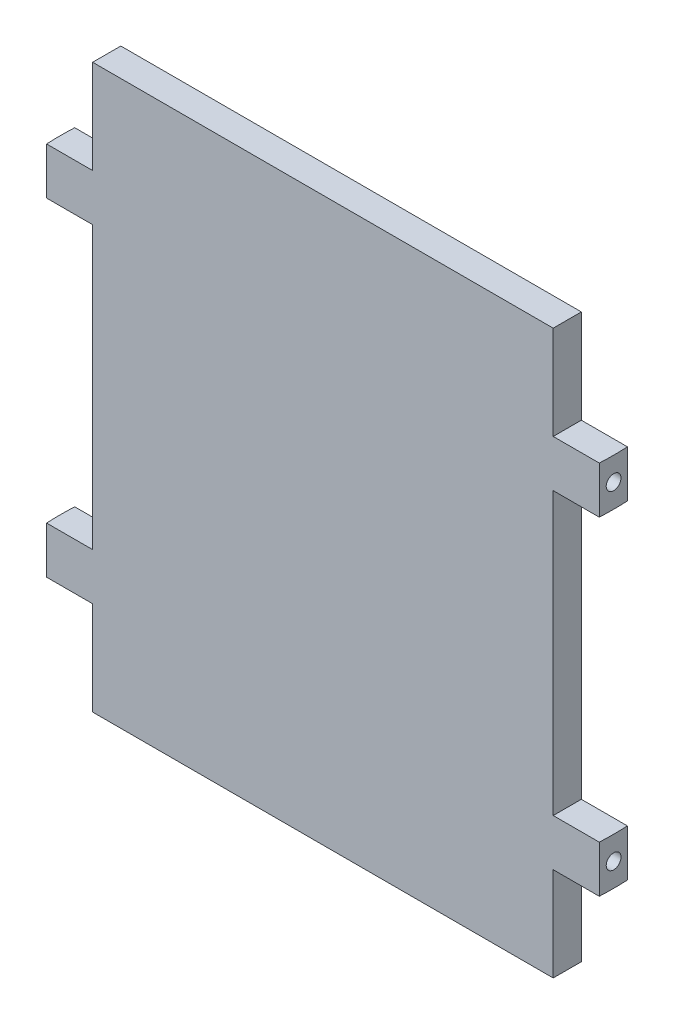
from build123d import *

# Parameters (mm, degrees)
Y_KSEKLIK_EKSTR_ZYON1_DEPTH             = 6
M3X0_5_HELISARMAL_IN_DI_LI_DELIK1_D     = 3.15
M3X0_5_HELISARMAL_IN_DI_LI_DELIK1_DEPTH = 7.5
M3X0_5_HELISARMAL_IN_DI_LI_DELIK1_TIP   = 0.946355475
M3X0_5_HELISARMAL_IN_DI_LI_DELIK2_D     = 3.15
M3X0_5_HELISARMAL_IN_DI_LI_DELIK2_DEPTH = 7.5
M3X0_5_HELISARMAL_IN_DI_LI_DELIK2_TIP   = 0.946355475
IZIM2_R                                 = 69
IZIM2_R_2                               = 59
KES_EKSTR_ZYON_NCE1_DEPTH               = 150


with BuildPart() as part:
    # Çizim1 → Yükseklik-Ekstrüzyon1 (new body)
    with BuildSketch(Plane.XY):
        Polygon((0, 20), (-10, 20), (-10, 30), (0, 30), (0, 90), (-10, 90), (-10, 100), (0, 100), (0, 120), (98.2, 120), (98.2, 100), (108.2, 100), (108.2, 90), (98.2, 90), (98.2, 30), (108.2, 30), (108.2, 20), (98.2, 20), (98.2, 0), (0, 0), align=None)
    extrude(amount=Y_KSEKLIK_EKSTR_ZYON1_DEPTH)

    # M3x0.5 Helisarmal İçin Dişli Delik1
    with Locations(Plane.ZY.offset(10)):
        with Locations((3, 25), (3, 95)):
            Hole(M3X0_5_HELISARMAL_IN_DI_LI_DELIK1_D / 2, depth=M3X0_5_HELISARMAL_IN_DI_LI_DELIK1_DEPTH)
            with Locations((0, 0, -(M3X0_5_HELISARMAL_IN_DI_LI_DELIK1_DEPTH + M3X0_5_HELISARMAL_IN_DI_LI_DELIK1_TIP / 2))):  # 118° drill point
                Cone(0, M3X0_5_HELISARMAL_IN_DI_LI_DELIK1_D / 2, M3X0_5_HELISARMAL_IN_DI_LI_DELIK1_TIP, mode=Mode.SUBTRACT)

    # M3x0.5 Helisarmal İçin Dişli Delik2
    with Locations(Plane(origin=(108.2, 0, 0), x_dir=(0, 0, -1), z_dir=(1, 0, 0))):
        with Locations((-3, 25), (-3, 95)):
            Hole(M3X0_5_HELISARMAL_IN_DI_LI_DELIK2_D / 2, depth=M3X0_5_HELISARMAL_IN_DI_LI_DELIK2_DEPTH)
            with Locations((0, 0, -(M3X0_5_HELISARMAL_IN_DI_LI_DELIK2_DEPTH + M3X0_5_HELISARMAL_IN_DI_LI_DELIK2_TIP / 2))):  # 118° drill point
                Cone(0, M3X0_5_HELISARMAL_IN_DI_LI_DELIK2_D / 2, M3X0_5_HELISARMAL_IN_DI_LI_DELIK2_TIP, mode=Mode.SUBTRACT)

    # Çizim2 → Kes-Ekstrüzyon-İnce1 (cut)
    with BuildSketch(Plane(origin=(0, 120, 0), x_dir=(1, 0, 0), z_dir=(0, 1, 0))):
        with Locations((49.1, -3)):
            Circle(IZIM2_R)
        with Locations((49.1, -3)):
            Circle(IZIM2_R_2, mode=Mode.SUBTRACT)
    extrude(amount=-KES_EKSTR_ZYON_NCE1_DEPTH, mode=Mode.SUBTRACT)


solid = part.part
